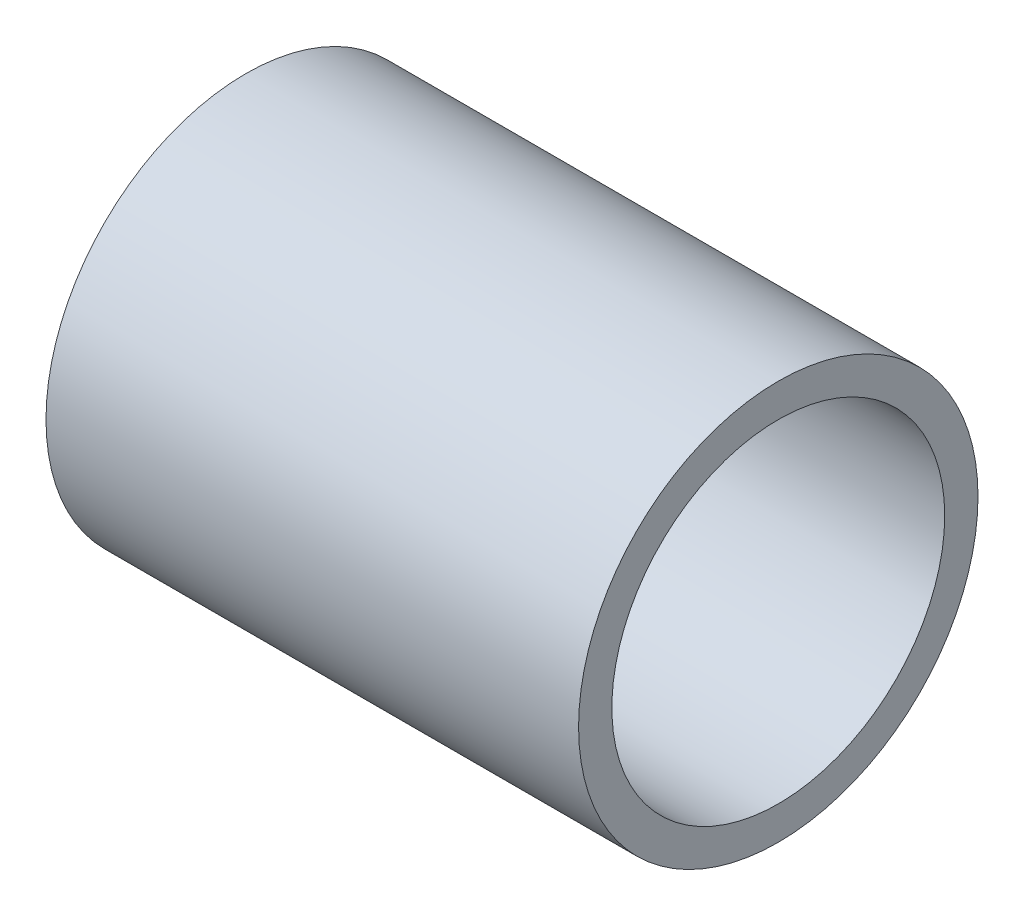
from build123d import *

# Parameters (mm, degrees)
SKETCH1_W = 25.4
SKETCH1_H = 1.5875


with BuildPart() as part:
    # Sketch1 → Revolve1 (revolve)
    with BuildSketch(Plane.XY, mode=Mode.PRIVATE) as revolve1_sk:
        with Locations((0, 8.73125)):
            Rectangle(SKETCH1_W, SKETCH1_H)
    revolve(revolve1_sk.sketch.rotate(Axis((12.596966995, 0, 0), (-1, 0, 0)), 90), axis=Axis((12.596966995, 0, 0), (-1, 0, 0)))


solid = part.part
